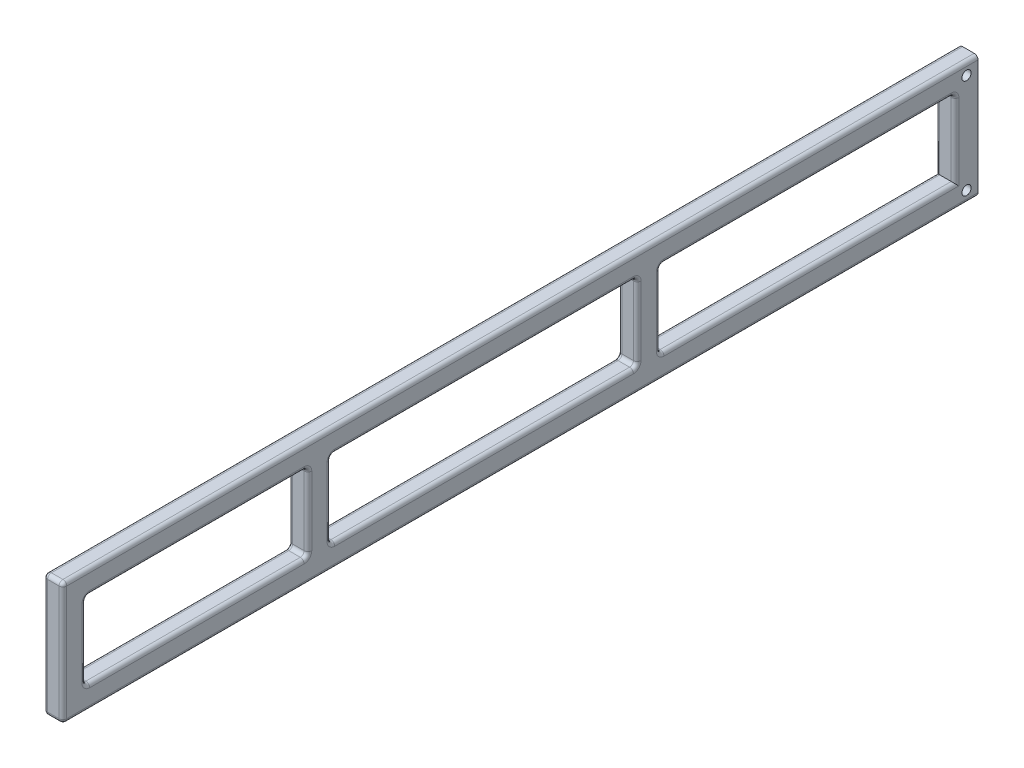
from build123d import *

# Parameters (mm, degrees)
ESBO_O8_W                = 80
ESBO_O8_H                = 20
ESBO_O8_W_2              = 77
ESBO_O8_W_3              = 58
RESSALTO_EXTRUS_O1_DEPTH = 5
FILETE1_R                = 1
ESBO_O9_R                = 1.2
CORTE_EXTRUS_O1_DEPTH    = 4


with BuildPart() as part:
    # Esboço8 → Ressalto-extrusão1 (new body)
    with BuildSketch(Plane(origin=(0, 0, 0), x_dir=(0, 0, -1), z_dir=(1, 0, 0))):
        Polygon((80.558629268, 10), (-158.441370732, 10), (-158.441370732, 42), (48.30242385, 42), (80.558629268, 42), align=None)
        with Locations((-48.441370732, 26)):
            Rectangle(ESBO_O8_W, ESBO_O8_H, mode=Mode.SUBTRACT)
        with Locations((36.058629268, 26)):
            Rectangle(ESBO_O8_W_2, ESBO_O8_H, mode=Mode.SUBTRACT)
        with Locations((-123.441370732, 26)):
            Rectangle(ESBO_O8_W_3, ESBO_O8_H, mode=Mode.SUBTRACT)
    extrude(amount=-RESSALTO_EXTRUS_O1_DEPTH)

    # Filete1
    filete1_edges = [part.edges().sort_by_distance(p)[0] for p in [
        (-5, 26, 158.441370732),
        (-5, 26, -74.558629268),
        (-2.5, 36, -74.558629268),
        (-5, 16, -36.058629268),
        (-5, 26, 2.441370732),
        (-2.5, 16, 2.441370732),
        (-5, 36, -36.058629268),
        (-2.5, 36, 2.441370732),
        (0, 26, -74.558629268),
        (0, 36, -36.058629268),
        (0, 26, 2.441370732),
        (0, 16, -36.058629268),
        (-5, 10, 38.941370732),
        (-5, 26, 152.441370732),
        (-2.5, 16, 152.441370732),
        (-5, 36, 123.441370732),
        (-2.5, 36, 152.441370732),
        (-5, 26, 94.441370732),
        (-2.5, 36, 94.441370732),
        (-5, 16, 123.441370732),
        (-2.5, 16, 94.441370732),
        (0, 26, 152.441370732),
        (0, 16, 123.441370732),
        (0, 26, 94.441370732),
        (0, 36, 123.441370732),
        (-5, 16, 48.441370732),
        (-2.5, 16, 8.441370732),
        (-5, 26, 88.441370732),
        (-2.5, 16, 88.441370732),
        (-5, 36, 48.441370732),
        (-2.5, 36, 88.441370732),
        (-5, 26, 8.441370732),
        (-2.5, 36, 8.441370732),
        (0, 16, 48.441370732),
        (0, 26, 8.441370732),
        (0, 36, 48.441370732),
        (0, 26, 88.441370732),
        (0, 10, 38.941370732),
        (0, 26, 158.441370732),
        (0, 42, 38.941370732),
        (-5, 42, 38.941370732),
        (-2.5, 10, 158.441370732),
        (-2.5, 42, 158.441370732),
    ]]
    fillet(filete1_edges, radius=FILETE1_R)

    # Esboço9 → Corte-extrusão1 (cut)
    with BuildSketch(Plane(origin=(0, 0, 0), x_dir=(0, 0, -1), z_dir=(1, 0, 0))):
        with Locations((77.568731319, 13)):
            Circle(ESBO_O9_R)
        with Locations((77.558629268, 39)):
            Circle(ESBO_O9_R)
    extrude(amount=-CORTE_EXTRUS_O1_DEPTH, mode=Mode.SUBTRACT)


solid = part.part
